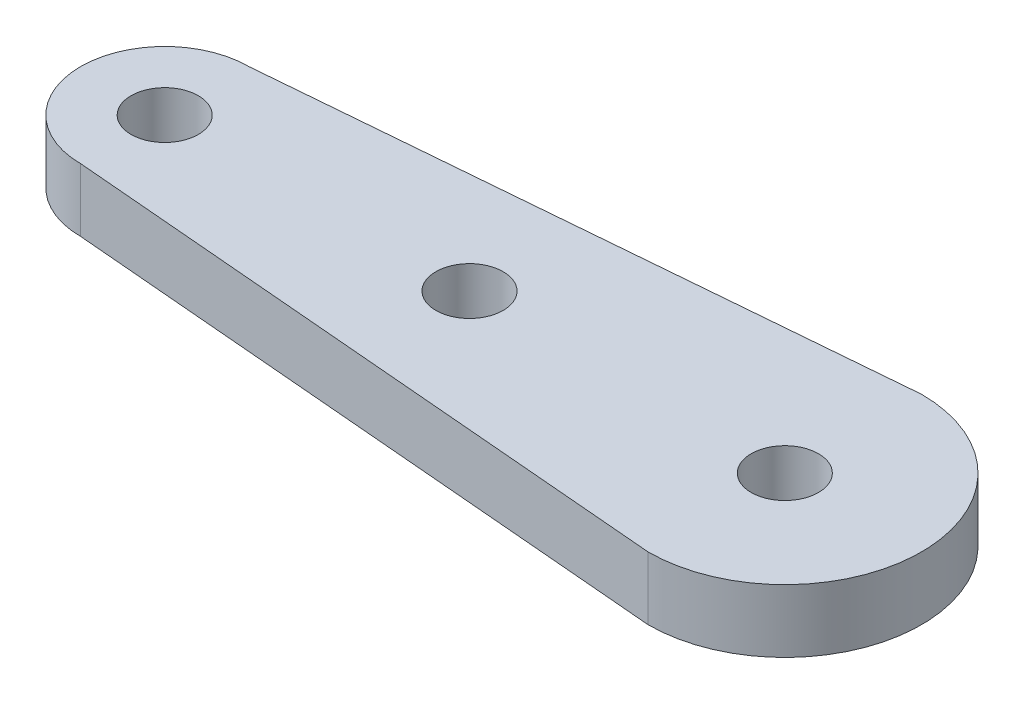
from build123d import *

# Parameters (mm, degrees)
SKETCH_1_R      = 1.6
EXTRUDE_1_DEPTH = 3


with BuildPart() as part:
    # ｽｹｯﾁ1 → ﾎﾞｽ - 押し出し1 (new body)
    with BuildSketch(Plane(origin=(0, 0, 0), x_dir=(1, 0, 0), z_dir=(0, 1, 0))):
        with BuildLine():
            Line((0, 6.5), (-29.5, 4))
            ThreePointArc((-29.5, 4), (-33.5, 0), (-29.5, -4))
            Line((-29.5, -4), (0, -6.5))
            ThreePointArc((0, -6.5), (6.5, 0), (0, 6.5))
        make_face()
        with Locations(Location((0, 0, 0), (0, 0, 270))):
            Circle(SKETCH_1_R, mode=Mode.SUBTRACT)
        with Locations(Location((-15, 0, 0), (0, 0, 270))):
            Circle(SKETCH_1_R, mode=Mode.SUBTRACT)
        with Locations(Location((-29.5, 0, 0), (0, 0, 270))):
            Circle(SKETCH_1_R, mode=Mode.SUBTRACT)
    extrude(amount=EXTRUDE_1_DEPTH)


solid = part.part
